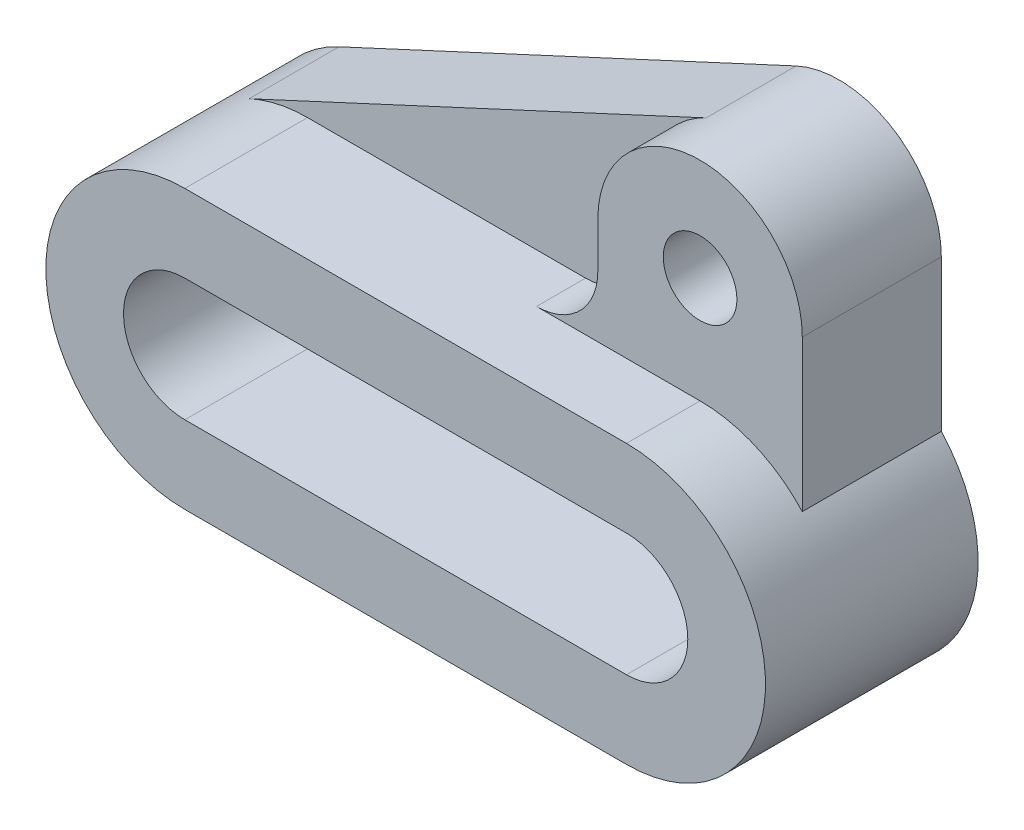
from build123d import *

# Parameters (mm, degrees)
BOSS_EXTRUDE1_DEPTH      = 26
BOSS_EXTRUDE1_DEPTH_BACK = 26
BOSS_EXTRUDE2_DEPTH      = 34
HOLE1_D                  = 18
BOSS_EXTRUDE3_DEPTH      = 22


with BuildPart() as part:
    # Sketch1 → Boss-Extrude1 (new, two sides: drawn at the far end of the back side and taken through both)
    with BuildSketch(Plane.XY.offset(-BOSS_EXTRUDE1_DEPTH_BACK)):
        with BuildLine():
            Line((-54, 34), (54, 34))
            ThreePointArc((54, 34), (88, 0), (54, -34))
            Line((54, -34), (-54, -34))
            ThreePointArc((-54, -34), (-88, 0), (-54, 34))
        make_face()
        with BuildLine():
            Line((-54, 15), (54, 15))
            ThreePointArc((54, 15), (69, 0), (54, -15))
            Line((54, -15), (-54, -15))
            ThreePointArc((-54, -15), (-69, 0), (-54, 15))
        make_face(mode=Mode.SUBTRACT)
    extrude(amount=BOSS_EXTRUDE1_DEPTH + BOSS_EXTRUDE1_DEPTH_BACK)

    # Sketch2 → Boss-Extrude2 (add)
    with BuildSketch(Plane(origin=(0, 0, -26), x_dir=(-1, 0, 0), z_dir=(0, 0, -1))):
        with BuildLine():
            Line((-29, 60), (-29, 49))
            ThreePointArc((-29, 49), (-24.606601718, 38.393398282), (-14, 34))
            Line((-14, 34), (-54, 34))
            ThreePointArc((-54, 34), (-67.647767834, 31.140623519), (-79, 23.043437244))
            Line((-79, 23.043437244), (-79, 60))
            ThreePointArc((-79, 60), (-54, 85), (-29, 60))
        make_face()
    extrude(amount=-BOSS_EXTRUDE2_DEPTH)

    # Hole1 (through all)
    with Locations(Plane(origin=(0, 0, -26), x_dir=(-1, 0, 0), z_dir=(0, 0, -1))):
        with Locations((-54, 60)):
            Hole(HOLE1_D / 2)

    # Sketch5 → Boss-Extrude3 (add)
    with BuildSketch(Plane(origin=(0, 0, -26), x_dir=(-1, 0, 0), z_dir=(0, 0, -1))):
        with BuildLine():
            Line((-14, 34), (54, 34))
            ThreePointArc((54, 34), (61.323344829, 33.201937), (68.302896095, 30.845212972))
            Line((68.302896095, 30.845212972), (-43.483164636, 82.680303656))
            ThreePointArc((-43.483164636, 82.680303656), (-32.929631184, 73.455094126), (-29, 60))
            Line((-29, 60), (-29, 49))
            ThreePointArc((-29, 49), (-24.606601718, 38.393398282), (-14, 34))
        make_face()
    extrude(amount=-BOSS_EXTRUDE3_DEPTH)


solid = part.part
